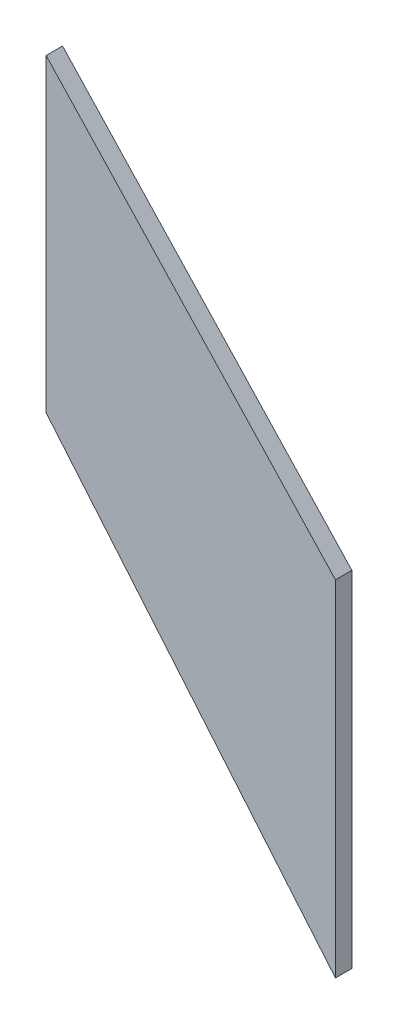
from build123d import *

# Parameters (mm, degrees)
SKETCH1_W           = 101.237370502
SKETCH1_H           = 95.893480298
BOSS_EXTRUDE1_DEPTH = 5.08
CUT_EXTRUDE1_DEPTH  = 50.8
SKETCH3_W           = 34.377834067
SKETCH3_H           = 141.590062345
CUT_EXTRUDE2_DEPTH  = 25.4
SKETCH4_R           = 1.4224
CUT_EXTRUDE3_DEPTH  = 5.08


with BuildPart() as part:
    # Sketch1 → Boss-Extrude1 (new body)
    with BuildSketch(Plane.XY):
        with Locations((-50.618685251, 168.596740149)):
            Rectangle(SKETCH1_W, SKETCH1_H)
        Polygon((-101.237370502, 120.65), (0, 120.65), (0, 0), align=None)
    extrude(amount=BOSS_EXTRUDE1_DEPTH)

    # Sketch2 → Cut-Extrude1 (cut)
    with BuildSketch(Plane.XY.offset(5.08)):
        Polygon((-101.237370502, 216.543480298), (0, 108.271740149), (0, 216.543480298), align=None)
    extrude(amount=-CUT_EXTRUDE1_DEPTH, mode=Mode.SUBTRACT)

    # Sketch3 → Cut-Extrude2 (cut)
    with BuildSketch(Plane.XY.offset(5.08)):
        with Locations((5.61014441, 62.39317364)):
            Rectangle(SKETCH3_W, SKETCH3_H)
    extrude(amount=-CUT_EXTRUDE2_DEPTH, mode=Mode.SUBTRACT)

    # Sketch4 → Cut-Extrude3 (cut)
    with BuildSketch(Plane(origin=(0, 0, 0), x_dir=(0, 0, 1), z_dir=(-0.7660444431189743, -0.6427876096865437, 0))):
        with Locations(Location((2.54, 26.412934343, 0), (0, 0, 270))):
            Circle(SKETCH4_R)
        with Locations(Location((2.54, 153.412934343, 0), (0, 0, 270))):
            Circle(SKETCH4_R)
    extrude(amount=-CUT_EXTRUDE3_DEPTH, mode=Mode.SUBTRACT)


solid = part.part
